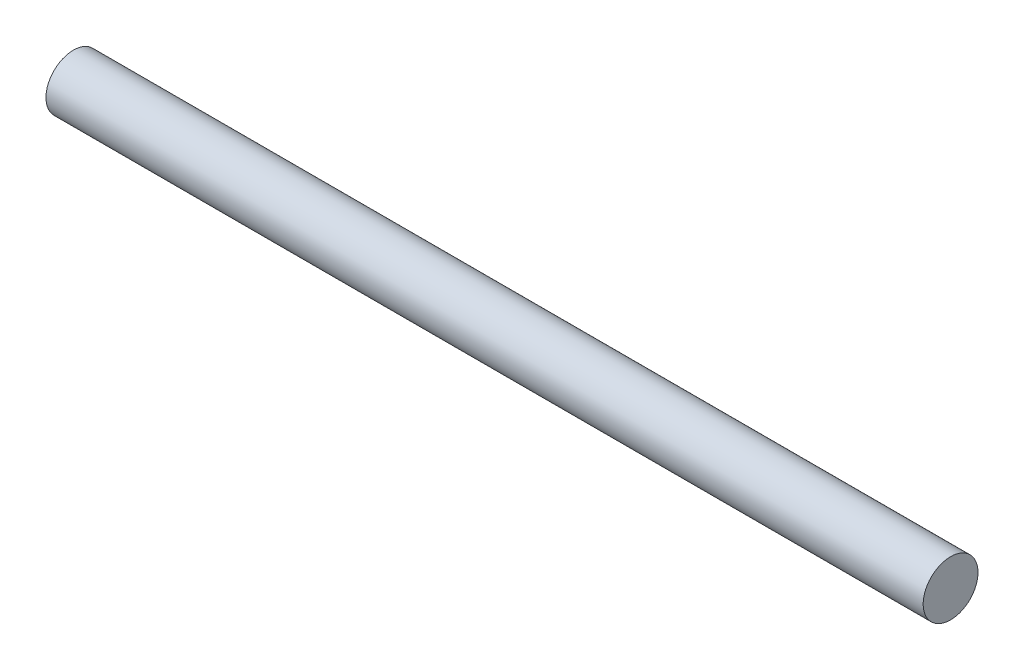
from build123d import *

# Parameters (mm, degrees)
SKETCH1_R           = 3.175
BOSS_EXTRUDE1_DEPTH = 101.6


with BuildPart() as part:
    # Sketch1 → Boss-Extrude1 (new body)
    with BuildSketch(Plane.YZ):
        with Locations(Location((0, 0, 0), (0, 0, 270))):
            Circle(SKETCH1_R)
    extrude(amount=BOSS_EXTRUDE1_DEPTH)


solid = part.part
